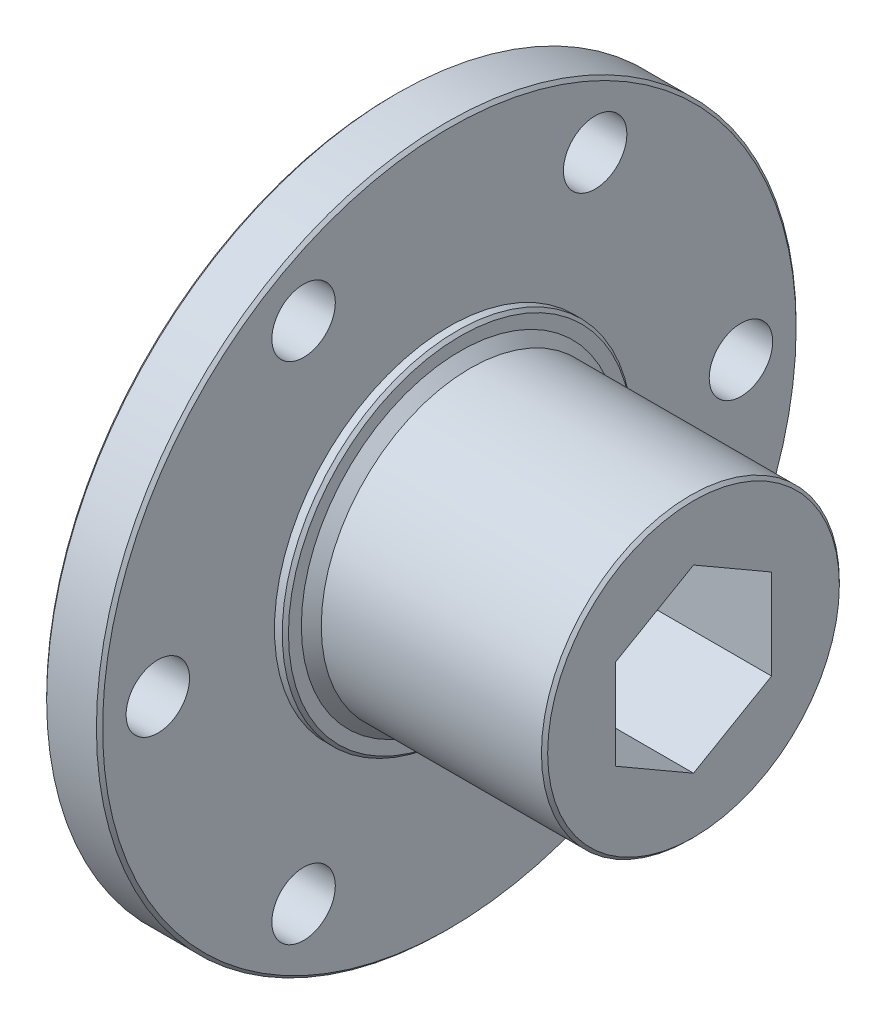
from build123d import *

# Parameters (mm, degrees)
SKETCH1_W           = 4.572
SKETCH1_H           = 28.575
SKETCH2_R           = 14.2875
BOSS_EXTRUDE1_DEPTH = 0.889
SKETCH3_R           = 12.9794
BOSS_EXTRUDE2_DEPTH = 0.8128
BOSS_EXTRUDE2_TAPER = 45
SKETCH4_R           = 12.1666
BOSS_EXTRUDE3_DEPTH = 18.2372
BOSS_EXTRUDE4_START = 0.889
SKETCH5_R           = 14.2875
BOSS_EXTRUDE4_DEPTH = 0.889
CUT_EXTRUDE1_DEPTH  = 48.730716001
HOLE1_D             = 5.1816
HOLE1_DEPTH         = 24.511
CHAMFER1_SIZE       = 0.254


with BuildPart() as part:
    # Sketch1 → Revolve1 (revolve)
    with BuildSketch(Plane(origin=(0, 0, 0), x_dir=(-1, 0, 0), z_dir=(0, 0, -1)), mode=Mode.PRIVATE) as revolve1_sk:
        with Locations((16.210066246, 14.2875)):
            Rectangle(SKETCH1_W, SKETCH1_H)
    revolve(revolve1_sk.sketch.rotate(Axis((-13.924066246, 0, 0), (-1, 0, 0)), 270), axis=Axis((-13.924066246, 0, 0), (-1, 0, 0)))

    # Sketch2 → Boss-Extrude1 (add)
    with BuildSketch(Plane(origin=(-13.924066246, 0, 0), x_dir=(0, 0, -1), z_dir=(1, 0, 0))):
        Circle(SKETCH2_R)
    extrude(amount=BOSS_EXTRUDE1_DEPTH)

    # Sketch3 → Boss-Extrude2 (add)
    with BuildSketch(Plane(origin=(-13.035066246, 0, 0), x_dir=(0, 0, -1), z_dir=(1, 0, 0))):
        Circle(SKETCH3_R)
    extrude(amount=BOSS_EXTRUDE2_DEPTH, taper=BOSS_EXTRUDE2_TAPER)

    # Sketch4 → Boss-Extrude3 (add)
    with BuildSketch(Plane(origin=(-12.222266246, 0, 0), x_dir=(0, 0, -1), z_dir=(1, 0, 0))):
        with Locations(Location((0, 0, 0), (0, 0, 180))):
            Circle(SKETCH4_R)
    extrude(amount=BOSS_EXTRUDE3_DEPTH)

    # Sketch5 → Boss-Extrude4 (add)
    with BuildSketch(Plane.ZY.offset(18.496066246).offset(BOSS_EXTRUDE4_START)):
        with Locations(Location((0, 0, 0), (0, 0, 180))):
            Circle(SKETCH5_R)
    extrude(amount=-BOSS_EXTRUDE4_DEPTH)

    # Sketch6 → Cut-Extrude1 (cut, through all)
    with BuildSketch(Plane.ZY.offset(19.385066246)):
        Polygon((0, 7.361657812), (-6.3754, 3.680818906), (-6.3754, -3.680858906), (0, -7.361697812), (6.3754, -3.680858906), (6.3754, 3.680818906), align=None)
    extrude(amount=-CUT_EXTRUDE1_DEPTH, mode=Mode.SUBTRACT)

    # Hole1
    with Locations(Plane.ZY.offset(18.496066246)):
        with Locations((11.90625, 20.622229928), (-23.8125, 0), (11.90625, -20.622229928), (-11.90625, -20.622229928), (-11.90625, 20.622229928), (23.8125, 0)):
            Hole(HOLE1_D / 2, depth=HOLE1_DEPTH)

    # Chamfer1
    chamfer1_edges = [part.edges().sort_by_distance(p)[0] for p in [
        (6.014933754, 0, -12.1666),
        (-19.385066246, 0, 14.2875),
        (-18.496066246, 0, -28.575),
        (-13.924066246, 0, -28.575),
        (-13.035066246, 0, 14.2875),
    ]]
    chamfer(chamfer1_edges, length=CHAMFER1_SIZE)


solid = part.part
